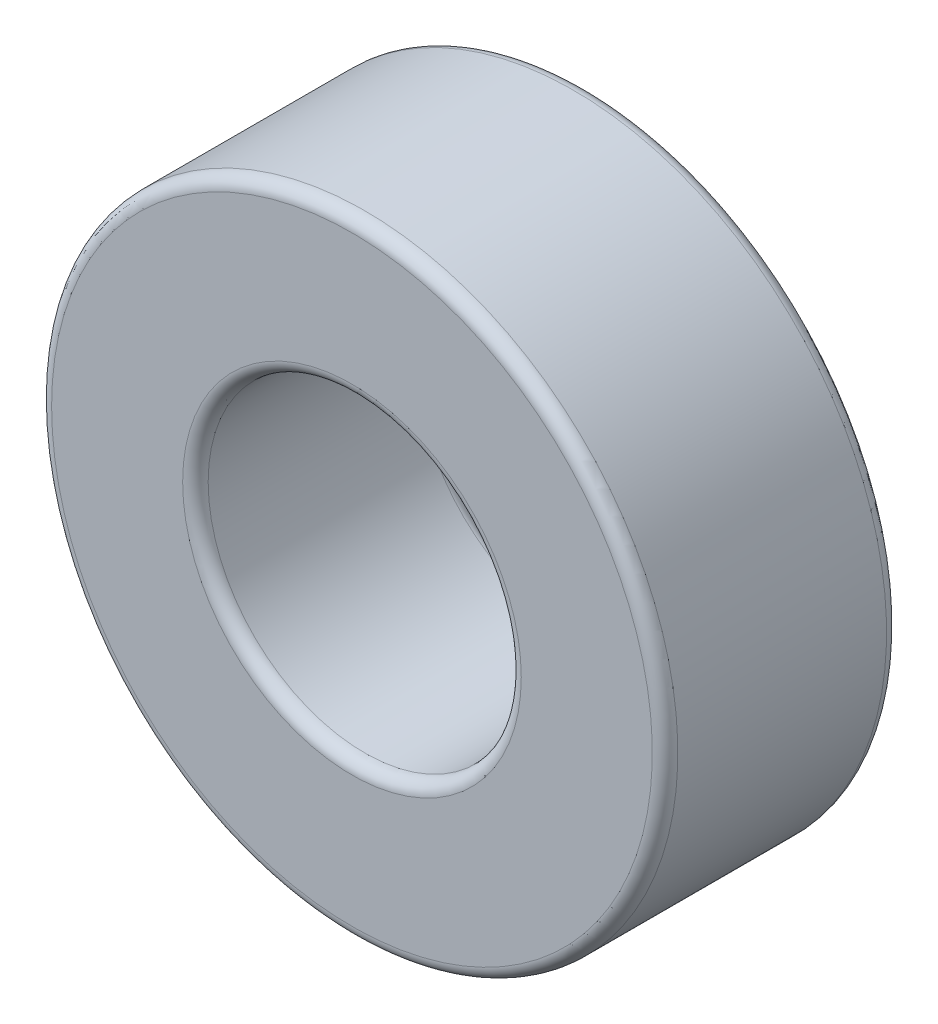
from build123d import *


with BuildPart() as part:
    # Sketch1 → Revolve1 (revolve)
    with BuildSketch(Plane(origin=(0, 0, 0), x_dir=(1, 0, 0), z_dir=(0, 1, 0))):
        with BuildLine():
            Line((0, 0), (0, 2))
            ThreePointArc((0, 2), (0.03579799, 2.086424), (0.122221986, 2.122222))
            Line((0.122221986, 2.122222), (1.377777546, 2.122222))
            ThreePointArc((1.377777546, 2.122222), (1.464201541, 2.086424015), (1.499999546, 2.000000028))
            Line((1.499999546, 2.000000028), (1.5, 2.8e-08))
            ThreePointArc((1.5, 2.8e-08), (1.46420195, -0.086424151), (1.37777778, -0.12222222))
            Line((1.37777778, -0.12222222), (0.12222222, -0.12222222))
            ThreePointArc((0.12222222, -0.12222222), (0.035798059, -0.086424161), (0, 0))
        make_face()
    revolve(axis=Axis((-1.5, 0, -2), (0, 0, 1)))


solid = part.part
